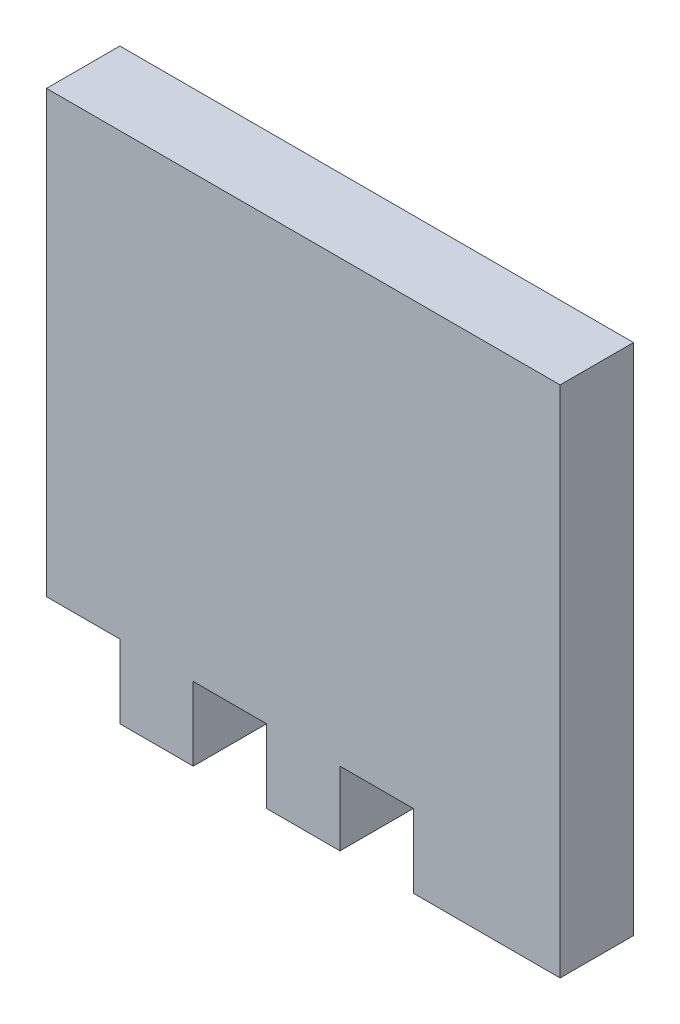
from build123d import *

# Parameters (mm, degrees)
BOSS_EXTRU_1_DEPTH = 5


with BuildPart() as part:
    # Esquisse1 → Boss.-Extru.1 (new body)
    with BuildSketch(Plane.XY):
        Polygon((-68.999916061, 0), (-63.999916061, 0), (-63.999916061, -5), (-58.999916061, -5), (-58.999916061, 0), (-53.999916061, 0), (-53.999916061, -5), (-48.999916061, -5), (-48.999916061, 0), (-43.999916061, 0), (-43.999916061, -5), (-33.999916061, -5), (-33.999916061, 30), (-68.999916061, 30), align=None)
    extrude(amount=BOSS_EXTRU_1_DEPTH)


solid = part.part
